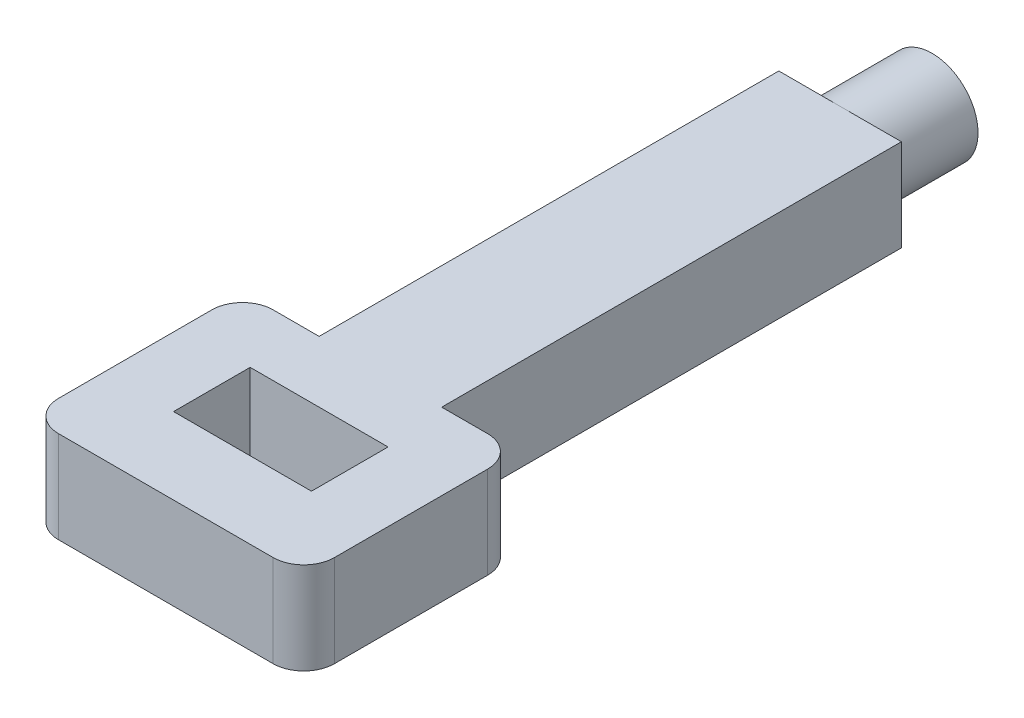
from build123d import *

# Parameters (mm, degrees)
CROQUIS1_W              = 4.5
CROQUIS1_H              = 2.5
SALIENTE_EXTRUIR1_DEPTH = 3
REDONDEO1_R             = 1
CROQUIS2_R              = 1.5
SALIENTE_EXTRUIR2_DEPTH = 3


with BuildPart() as part:
    # Croquis1 → Saliente-Extruir1 (new body)
    with BuildSketch(Plane(origin=(0, 0, 0), x_dir=(1, 0, 0), z_dir=(0, 1, 0))):
        Polygon((4.5, 0), (-4.5, 0), (-4.5, 7), (-2, 7), (-2, 22), (2, 22), (2, 7), (4.5, 7), align=None)
        with Locations((0, 3.75)):
            Rectangle(CROQUIS1_W, CROQUIS1_H, mode=Mode.SUBTRACT)
    extrude(amount=SALIENTE_EXTRUIR1_DEPTH)

    # Redondeo1
    redondeo1_edges = [part.edges().sort_by_distance(p)[0] for p in [
        (-4.5, 1.5, -7),
        (4.5, 1.5, -7),
        (4.5, 1.5, 0),
        (-4.5, 1.5, 0),
    ]]
    fillet(redondeo1_edges, radius=REDONDEO1_R)

    # Croquis2 → Saliente-Extruir2 (add)
    with BuildSketch(Plane(origin=(0, 0, -22), x_dir=(-1, 0, 0), z_dir=(0, 0, -1))):
        with Locations(Location((0, 1.5, 0), (0, 0, 270))):
            Circle(CROQUIS2_R)
    extrude(amount=SALIENTE_EXTRUIR2_DEPTH)


solid = part.part
